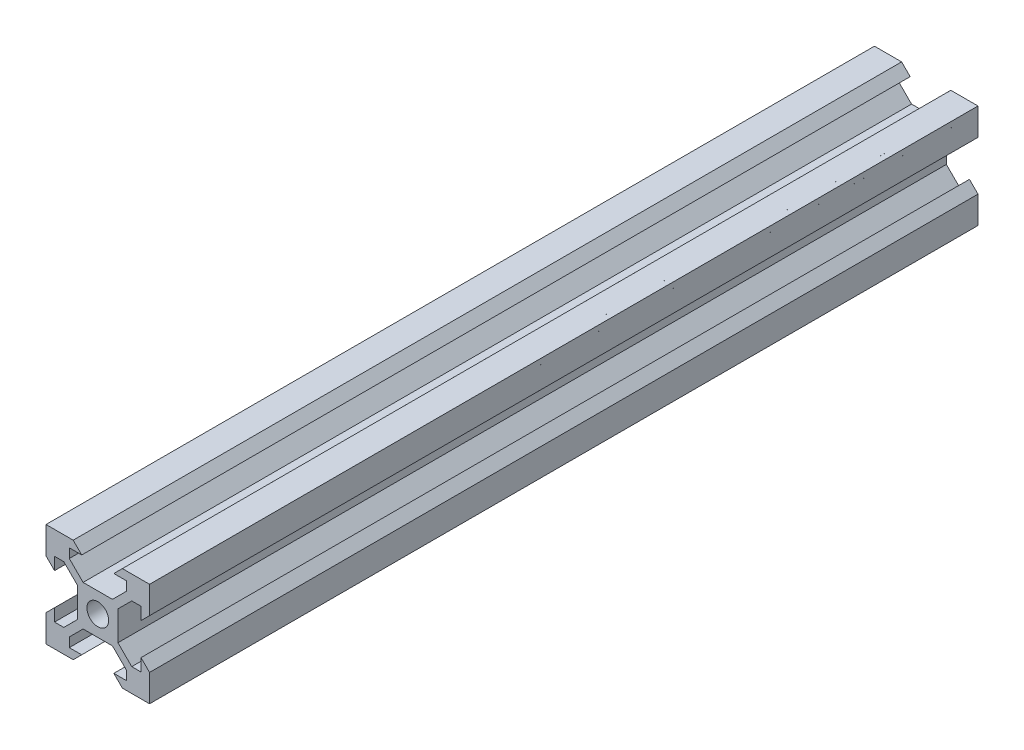
from build123d import *

# Parameters (mm, degrees)
SKETCH1_R           = 2.1
BOSS_EXTRUDE1_DEPTH = 80


with BuildPart() as part:
    # Sketch1 → Boss-Extrude1 (new, symmetric)
    with BuildSketch(Plane.XY):
        Polygon((2.834320347, 3.893970342), (5.5, 6.558849663), (5.5, 8.349069506), (3.1, 8.349069506), (4.75, 9.998574117), (10, 9.998574117), (10, 4.746997406), (8.35, 3.097492795), (8.350720674, 5.497492687), (6.560500912, 5.498030255), (3.894821259, 2.833150935), (3.894821259, -2.833150935), (6.560500912, -5.498030255), (8.350720674, -5.497492687), (8.35, -3.097492795), (10, -4.746997406), (10, -9.998574117), (4.75, -9.998574117), (3.1, -8.349069506), (5.5, -8.349069506), (5.5, -6.558849663), (2.834320347, -3.893970342), (-2.834320347, -3.893970342), (-5.5, -6.558849663), (-5.5, -8.349069506), (-3.1, -8.349069506), (-4.75, -9.998574117), (-10, -9.998574117), (-10, -4.746997406), (-8.35, -3.097492795), (-8.350720674, -5.497492687), (-6.560500912, -5.498030255), (-3.894821259, -2.833150935), (-3.894821259, 2.833150935), (-6.560500912, 5.498030255), (-8.350720674, 5.497492687), (-8.35, 3.097492795), (-10, 4.746997406), (-10, 9.998574117), (-4.75, 9.998574117), (-3.1, 8.349069506), (-5.5, 8.349069506), (-5.5, 6.558849663), (-2.834320347, 3.893970342), align=None)
        Circle(SKETCH1_R, mode=Mode.SUBTRACT)
    extrude(amount=BOSS_EXTRUDE1_DEPTH, both=True)


solid = part.part
